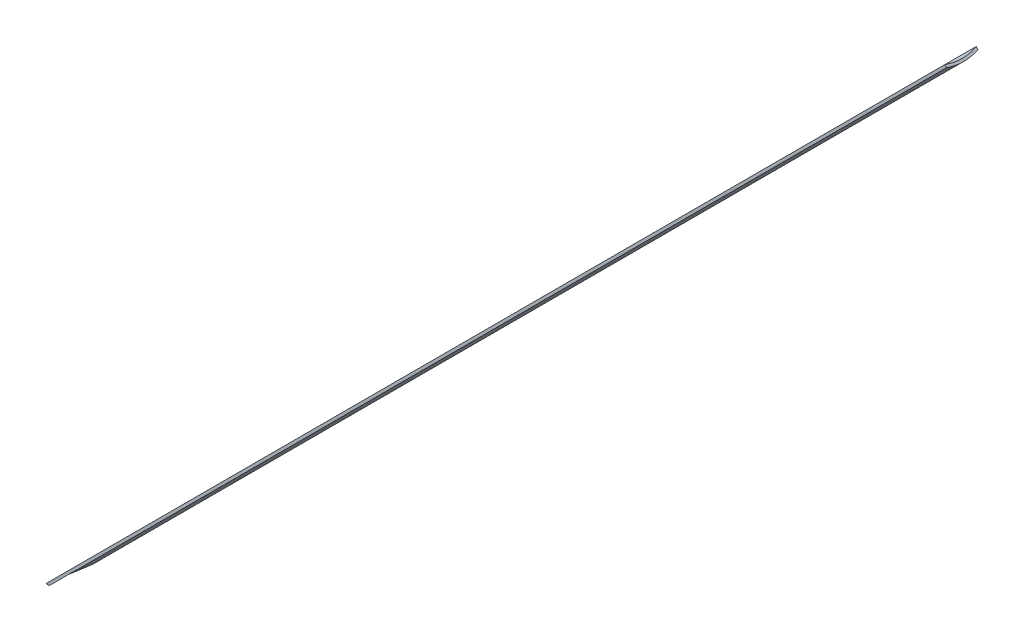
from build123d import *

# Parameters (mm, degrees)
BOSS_EXTRUDE1_DEPTH = 6.5
BOSS_EXTRUDE4_DEPTH = 254


with BuildPart() as part:
    # Sketch1 → Boss-Extrude1 (new body)
    with BuildSketch(Plane.XY):
        Polygon((0.353553391, 0), (-0.353553391, 0), (3.889087297, 4.242640687), (4.242640687, 3.889087297), align=None)
    extrude(amount=BOSS_EXTRUDE1_DEPTH)

    # Sketch2 → Loft1 section 0
    with BuildSketch(Plane(origin=(4.065863992, 4.065863992, 0), x_dir=(0, 0, -1), z_dir=(0.707106781186551, 0.7071067811865441, 0))):
        with BuildLine():
            Line((0, -0.25), (0, 0.25))
            Line((0, 0.25), (-6.5, 0.25))
            Line((-6.5, 0.25), (-6.5, -0.25))
            Line((-6.5, -0.25), (0, -0.25))
        make_face()
    # Sketch3 for Loft1 → Loft1 section 1
    with BuildSketch(Plane(origin=(6.187184335, 6.187184335, 0), x_dir=(0, 0, -1), z_dir=(0.7071067811865509, 0.7071067811865441, 0))):
        with BuildLine():
            Line((-6.5, 0.25), (-6.5, -0.273096719))
            # circular arc as an exact rational Bezier (weights 1, cos(half-angle), 1)
            Bezier((-6.5, -0.273096719), (-3.25, -1.247893057), (0, -0.273096719), weights=[1, 0.957842804, 1])
            Line((0, -0.273096719), (0, 0.25))
            Bezier((0, 0.25), (-3.25, -0.774242424), (-6.5, 0.25), weights=[1, 0.953757225, 1])
        make_face()
    loft()

    # Sketch6 → Boss-Extrude4 (add)
    with BuildSketch(Plane(origin=(6.187184335, 6.187184335, 0), x_dir=(0, 0, -1), z_dir=(0.7071067811865509, 0.7071067811865441, 0))):
        with BuildLine():
            Line((-6.5, 0.25), (-6.5, -0.273096719))
            ThreePointArc((-6.5, -0.273096719), (-3.25, -0.75), (0, -0.273096719))
            Line((0, -0.273096719), (0, 0.25))
            ThreePointArc((0, 0.25), (-3.25, -0.25), (-6.5, 0.25))
        make_face()
    extrude(amount=BOSS_EXTRUDE4_DEPTH)


solid = part.part
